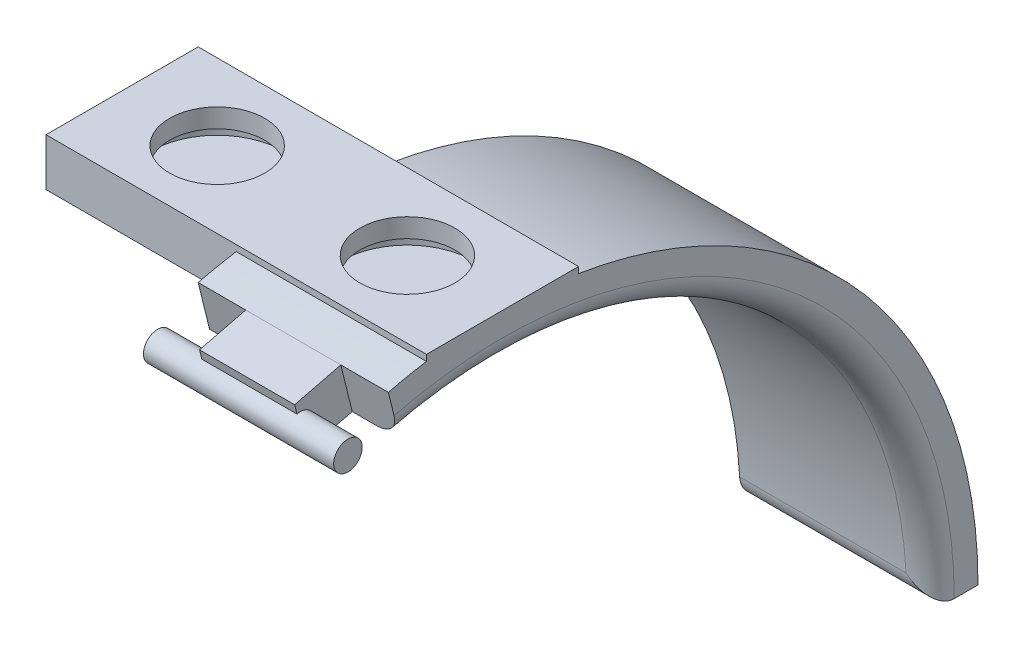
from build123d import *

# Parameters (mm, degrees)
BOSS_EXTRUDE1_DEPTH      = 20
BOSS_EXTRUDE2_DEPTH      = 20
BOSS_EXTRUDE2_DEPTH_BACK = 20
SKETCH4_R                = 5
CUT_EXTRUDE1_DEPTH       = 2
SKETCH5_R                = 7
CUT_EXTRUDE2_DEPTH       = 2
SKETCH16_W               = 20
SKETCH16_H               = 5
SKETCH17_W               = 5
SKETCH17_H               = 5
BOSS_EXTRUDE10_DEPTH     = 5
SKETCH18_R               = 1.5
BOSS_EXTRUDE11_DEPTH     = 10
SKETCH19_R               = 5
CUT_EXTRUDE3_DEPTH       = 2
SKETCH20_R               = 7
CUT_EXTRUDE4_DEPTH       = 2
FILLET2_R                = 2.5


with BuildPart() as part:
    # Sketch2 → Boss-Extrude1 (new body)
    with BuildSketch(Plane(origin=(0, 0, 0), x_dir=(0, 0, -1), z_dir=(1, 0, 0))):
        with BuildLine():
            Line((-50, 0), (-45, 0))
            ThreePointArc((-45, 0), (0, 45), (45, 0))
            Line((45, 0), (50, 0))
            ThreePointArc((50, 0), (0, 50), (-50, 0))
        make_face()
    extrude(amount=BOSS_EXTRUDE1_DEPTH)

    # Sketch3 → Boss-Extrude2 (add, two sides: drawn at the far end of the back side and taken through both)
    with BuildSketch(Plane(origin=(0, 0, 0), x_dir=(0, 0, -1), z_dir=(1, 0, 0)).offset(-BOSS_EXTRUDE2_DEPTH_BACK)):
        Polygon((0, 45), (8, 45), (8, 50), (-8, 50), (-8, 45), align=None)
    extrude(amount=BOSS_EXTRUDE2_DEPTH + BOSS_EXTRUDE2_DEPTH_BACK)

    # Sketch4 → Cut-Extrude1 (cut)
    with BuildSketch(Plane(origin=(0, 50, 0), x_dir=(1, 0, 0), z_dir=(0, 1, 0))):
        with Locations((10, 0)):
            Circle(SKETCH4_R)
    extrude(amount=-CUT_EXTRUDE1_DEPTH, mode=Mode.SUBTRACT)

    # Sketch5 → Cut-Extrude2 (cut)
    with BuildSketch(Plane(origin=(0, 48, 0), x_dir=(1, 0, 0), z_dir=(0, 1, 0))):
        with Locations((10, 0)):
            Circle(SKETCH5_R)
    extrude(amount=-CUT_EXTRUDE2_DEPTH, mode=Mode.SUBTRACT)

    # Cut-Sweep1: sweep along a path in Sketch15
    with BuildLine(Plane.ZY) as cut_sweep1_path:
        ThreePointArc((50, 0), (39.37003937, 30.822070015), (12, 48.538644398))
    # Sketch16 → Cut-Sweep1 (sweep, cut)
    with BuildSketch(Plane.XZ):
        with Locations((10, 47.5)):
            Rectangle(SKETCH16_W, SKETCH16_H)
    sweep(path=cut_sweep1_path.line, mode=Mode.SUBTRACT)

    # Sketch17 → Boss-Extrude10 (add)
    with BuildSketch(Plane(origin=(0, 0, 0), x_dir=(1, 0, 0), z_dir=(0, -0.24000000000000005, 0.9707728879609278))):
        with Locations((7.5, 47.5)):
            Rectangle(SKETCH17_W, SKETCH17_H)
    boss_extrude10 = extrude(amount=BOSS_EXTRUDE10_DEPTH)

    # Sketch18 → Boss-Extrude11 (add)
    with BuildSketch(Plane(origin=(10, 0, 0), x_dir=(0, 0, -1), z_dir=(1, 0, 0))):
        with Locations((-16.25386444, 44.911712178)):
            Circle(SKETCH18_R)
    boss_extrude11 = extrude(amount=-BOSS_EXTRUDE11_DEPTH)

    # Mirror1: Boss-Extrude10, Boss-Extrude11 across plane
    add(boss_extrude10.mirror(Plane(origin=(10, 42.484779958, 15.65386444), x_dir=(0, 0, 1), z_dir=(-1, 0, 0))))
    add(boss_extrude11.mirror(Plane(origin=(10, 42.484779958, 15.65386444), x_dir=(0, 0, 1), z_dir=(-1, 0, 0))))

    # Sketch19 → Cut-Extrude3 (cut)
    with BuildSketch(Plane(origin=(0, 50, 0), x_dir=(1, 0, 0), z_dir=(0, 1, 0))):
        with Locations((-10, 0)):
            Circle(SKETCH19_R)
    extrude(amount=-CUT_EXTRUDE3_DEPTH, mode=Mode.SUBTRACT)

    # Sketch20 → Cut-Extrude4 (cut)
    with BuildSketch(Plane(origin=(0, 48, 0), x_dir=(1, 0, 0), z_dir=(0, 1, 0))):
        with Locations((-10, 0)):
            Circle(SKETCH20_R)
    extrude(amount=-CUT_EXTRUDE4_DEPTH, mode=Mode.SUBTRACT)

    # Fillet2
    fillet2_edges = [part.edges().sort_by_distance(p)[0] for p in [
        (20, 35.433035433, -27.739863013),
        (10, 0, -45),
    ]]
    fillet(fillet2_edges, radius=FILLET2_R)


solid = part.part
